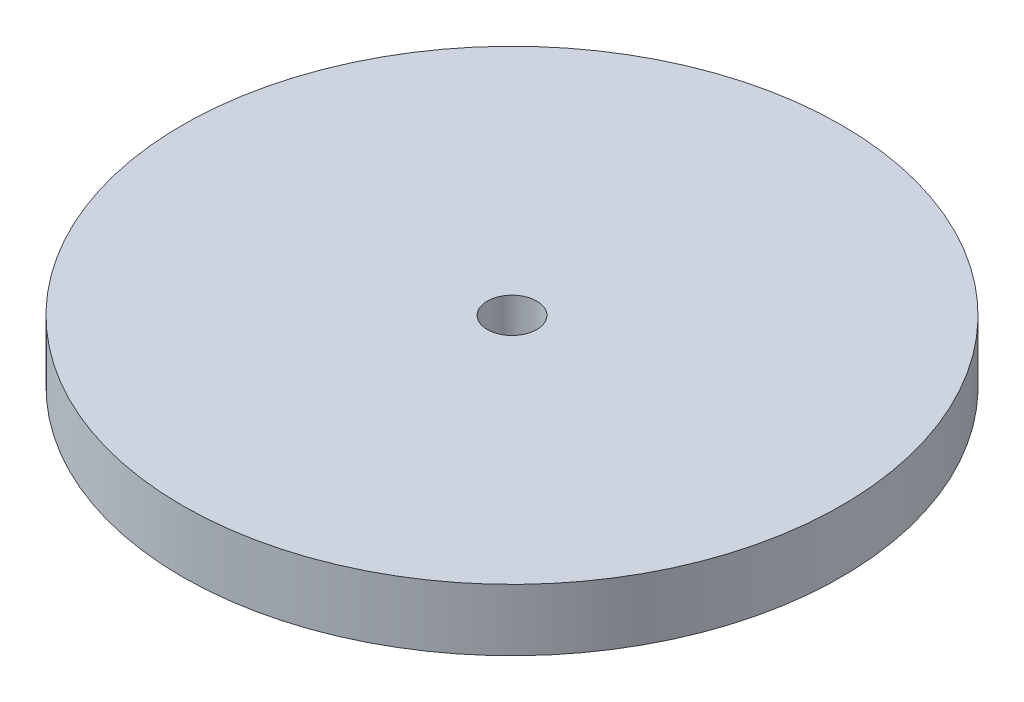
from build123d import *

# Parameters (mm, degrees)
ESBO_O1_R                = 80
RESSALTO_EXTRUS_O1_DEPTH = 15
ESBO_O2_R                = 6
CORTE_EXTRUS_O1_DEPTH    = 15


with BuildPart() as part:
    # Esboço1 → Ressalto-extrusão1 (new body)
    with BuildSketch(Plane(origin=(0, 0, 0), x_dir=(1, 0, 0), z_dir=(0, 1, 0))):
        with Locations(Location((0, 0, 0), (0, 0, 270))):
            Circle(ESBO_O1_R)
    extrude(amount=RESSALTO_EXTRUS_O1_DEPTH)

    # Esboço2 → Corte-extrusão1 (cut)
    with BuildSketch(Plane(origin=(0, 0, 0), x_dir=(1, 0, 0), z_dir=(0, 1, 0))):
        with Locations(Location((0, 0, 0), (0, 0, 270))):
            Circle(ESBO_O2_R)
    extrude(amount=CORTE_EXTRUS_O1_DEPTH, mode=Mode.SUBTRACT)


solid = part.part
